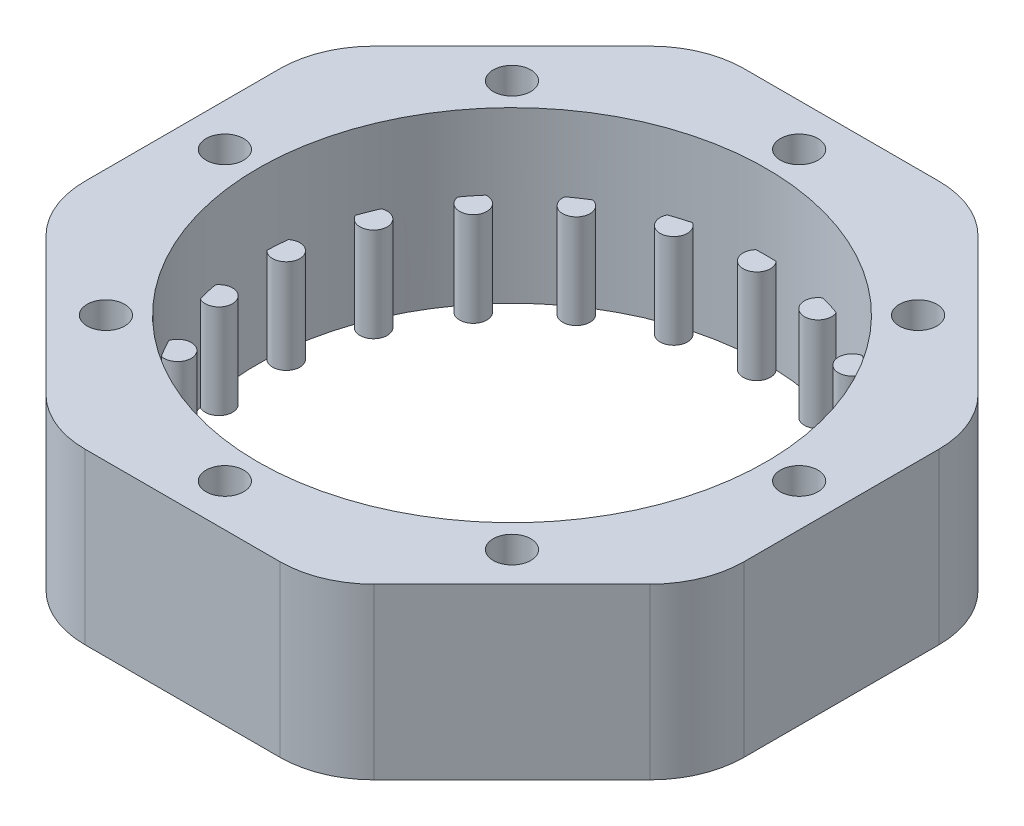
from build123d import *

# Parameters (mm, degrees)
SKETCH1_R           = 32
SKETCH1_R_2         = 27
BOSS_EXTRUDE1_DEPTH = 18
SKETCH2_R           = 1.45
BOSS_EXTRUDE2_DEPTH = 10
SKETCH4_R           = 32
BOSS_EXTRUDE3_DEPTH = 18
SKETCH5_R           = 2
CUT_EXTRUDE2_DEPTH  = 53.668776329
SKETCH3_R           = 2
CUT_EXTRUDE3_DEPTH  = 53.668776329


with BuildPart() as part:
    # Sketch1 → Boss-Extrude1 (new body)
    with BuildSketch(Plane(origin=(0, 0, 0), x_dir=(1, 0, 0), z_dir=(0, 1, 0))):
        with Locations(Location((0, 0, 0), (0, 0, 270))):
            Circle(SKETCH1_R)
        with Locations(Location((0, 0, 0), (0, 0, 270))):
            Circle(SKETCH1_R_2, mode=Mode.SUBTRACT)
    extrude(amount=BOSS_EXTRUDE1_DEPTH)

    # Sketch2 → Boss-Extrude2 (add)
    with BuildSketch(Plane(origin=(0, 0, 0), x_dir=(1, 0, 0), z_dir=(0, 1, 0))):
        with Locations((0, 26)):
            Circle(SKETCH2_R)
        with Locations((7.663634535, 24.84489295)):
            Circle(SKETCH2_R)
        with Locations((14.64632151, 21.482208132)):
            Circle(SKETCH2_R)
        with Locations((20.327618544, 16.210734848)):
            Circle(SKETCH2_R)
        with Locations((24.202717465, 9.498866634)):
            Circle(SKETCH2_R)
        with Locations((25.927298727, 1.942982433)):
            Circle(SKETCH2_R)
        with Locations((25.348125717, -5.785544283)):
            Circle(SKETCH2_R)
        with Locations((22.516660498, -13)):
            Circle(SKETCH2_R)
        with Locations((17.684491182, -19.059348668)):
            Circle(SKETCH2_R)
        with Locations((11.280977217, -23.425190565)):
            Circle(SKETCH2_R)
        with Locations((3.875098921, -25.709601482)):
            Circle(SKETCH2_R)
        with Locations((-3.875098921, -25.709601482)):
            Circle(SKETCH2_R)
        with Locations((-11.280977217, -23.425190565)):
            Circle(SKETCH2_R)
        with Locations((-17.684491182, -19.059348668)):
            Circle(SKETCH2_R)
        with Locations((-22.516660498, -13)):
            Circle(SKETCH2_R)
        with Locations((-25.348125717, -5.785544283)):
            Circle(SKETCH2_R)
        with Locations((-25.927298727, 1.942982433)):
            Circle(SKETCH2_R)
        with Locations((-24.202717465, 9.498866634)):
            Circle(SKETCH2_R)
        with Locations((-20.327618544, 16.210734848)):
            Circle(SKETCH2_R)
        with Locations((-14.64632151, 21.482208132)):
            Circle(SKETCH2_R)
        with Locations((-7.663634535, 24.84489295)):
            Circle(SKETCH2_R)
    extrude(amount=BOSS_EXTRUDE2_DEPTH)

    # Sketch4 → Boss-Extrude3 (add)
    with BuildSketch(Plane(origin=(0, 0, 0), x_dir=(1, 0, 0), z_dir=(0, 1, 0))):
        with BuildLine():
            Line((10.355339059, 35), (-10.355339059, 35))
            ThreePointArc((-10.355339059, 35), (-14.182173383, 34.238795325), (-17.426406871, 32.071067812))
            Line((-17.426406871, 32.071067812), (-32.071067812, 17.426406871))
            ThreePointArc((-32.071067812, 17.426406871), (-34.238795325, 14.182173383), (-35, 10.355339059))
            Line((-35, 10.355339059), (-35, -10.355339059))
            ThreePointArc((-35, -10.355339059), (-34.238795325, -14.182173383), (-32.071067812, -17.426406871))
            Line((-32.071067812, -17.426406871), (-17.426406871, -32.071067812))
            ThreePointArc((-17.426406871, -32.071067812), (-14.182173383, -34.238795325), (-10.355339059, -35))
            Line((-10.355339059, -35), (10.355339059, -35))
            ThreePointArc((10.355339059, -35), (14.182173383, -34.238795325), (17.426406871, -32.071067812))
            Line((17.426406871, -32.071067812), (32.071067812, -17.426406871))
            ThreePointArc((32.071067812, -17.426406871), (34.238795325, -14.182173383), (35, -10.355339059))
            Line((35, -10.355339059), (35, 10.355339059))
            ThreePointArc((35, 10.355339059), (34.238795325, 14.182173383), (32.071067812, 17.426406871))
            Line((32.071067812, 17.426406871), (17.426406871, 32.071067812))
            ThreePointArc((17.426406871, 32.071067812), (14.182173383, 34.238795325), (10.355339059, 35))
        make_face()
        Circle(SKETCH4_R, mode=Mode.SUBTRACT)
    extrude(amount=BOSS_EXTRUDE3_DEPTH)

    # Sketch5 → Cut-Extrude2 (cut, through all)
    with BuildSketch(Plane(origin=(0, 18, 0), x_dir=(1, 0, 0), z_dir=(0, 1, 0))):
        with Locations(Location((-21.566756826, 21.566756826, 0), (0, 0, 270))):
            Circle(SKETCH5_R)
        with Locations(Location((21.566756826, 21.566756826, 0), (0, 0, 270))):
            Circle(SKETCH5_R)
        with Locations(Location((21.566756826, -21.566756826, 0), (0, 0, 270))):
            Circle(SKETCH5_R)
        with Locations(Location((-21.566756826, -21.566756826, 0), (0, 0, 270))):
            Circle(SKETCH5_R)
    extrude(amount=-CUT_EXTRUDE2_DEPTH, mode=Mode.SUBTRACT)

    # Sketch3 → Cut-Extrude3 (cut, through all)
    with BuildSketch(Plane(origin=(0, 18, 0), x_dir=(1, 0, 0), z_dir=(0, 1, 0))):
        with Locations(Location((0, 30.5, 0), (0, 0, 270))):
            Circle(SKETCH3_R)
        with Locations(Location((30.5, 0, 0), (0, 0, 270))):
            Circle(SKETCH3_R)
        with Locations(Location((0, -30.5, 0), (0, 0, 270))):
            Circle(SKETCH3_R)
        with Locations(Location((-30.5, 0, 0), (0, 0, 270))):
            Circle(SKETCH3_R)
    extrude(amount=-CUT_EXTRUDE3_DEPTH, mode=Mode.SUBTRACT)


solid = part.part
